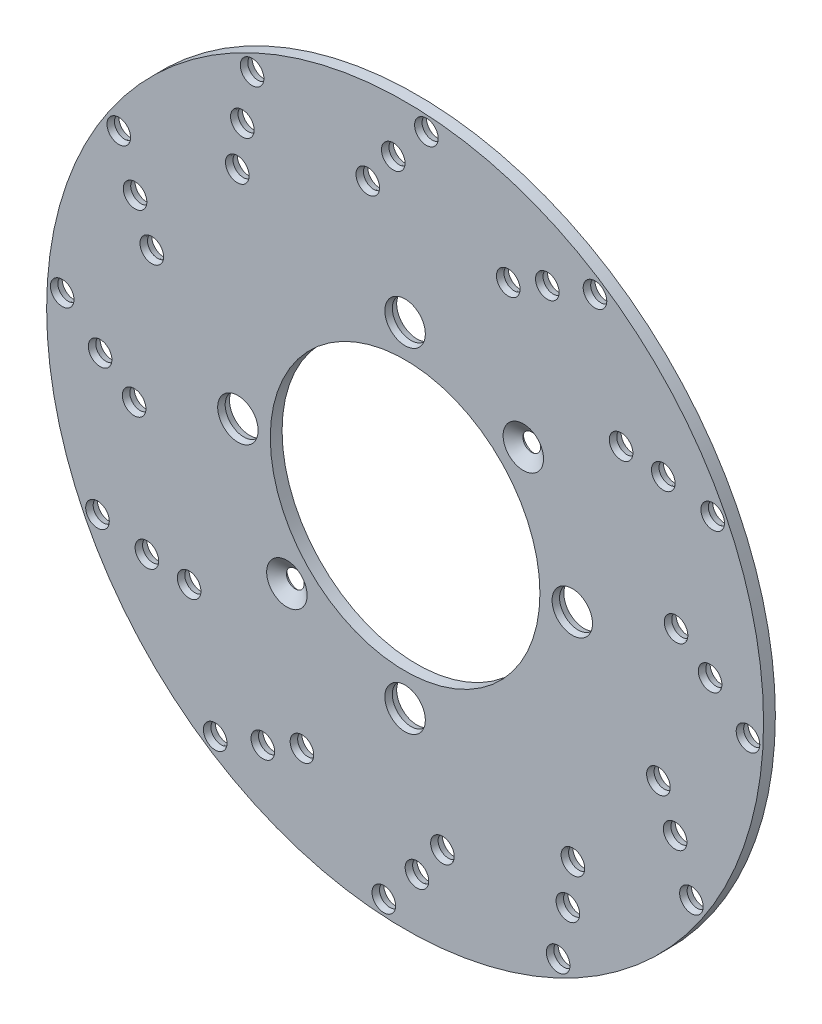
from build123d import *

# Parameters (mm, degrees)
SKETCH_1_R                    = 106.35
SKETCH_1_R_2                  = 40
EXTRUDE_1_DEPTH               = 3.5
SKETCH_2_R                    = 3.5
CUT_EXTRUDE_1_DEPTH           = 1.75
CUT_EXTRUDE_1_TAPER           = 15
CUT_EXTRUDE_START             = -3.5
SKETCH_2_6_R                  = 3.5
CUT_EXTRUDE_2_DEPTH           = 1.75
CUT_EXTRUDE_2_TAPER           = 15
SKETCH_2_7_R                  = 6
CUT_EXTRUDE_3_DEPTH           = 1.75
CUT_EXTRUDE_3_DRAFT           = -15
CUT_EXTRUDE_3_PROFILE_2_DEPTH = 1.75
CUT_EXTRUDE_3_PROFILE_2_DRAFT = -15
CUT_EXTRUDE_3_PROFILE_3_DEPTH = 1.75
CUT_EXTRUDE_3_PROFILE_3_DRAFT = -15
CUT_EXTRUDE_3_PROFILE_4_DEPTH = 1.75
CUT_EXTRUDE_3_PROFILE_4_DRAFT = -15
SKETCH_2_8_R                  = 6
CUT_EXTRUDE_4_DEPTH           = 1.75
CUT_EXTRUDE_4_DRAFT           = 15
CUT_EXTRUDE_4_PROFILE_2_DEPTH = 1.75
CUT_EXTRUDE_4_PROFILE_2_DRAFT = 15
CUT_EXTRUDE_4_PROFILE_3_DEPTH = 1.75
CUT_EXTRUDE_4_PROFILE_3_DRAFT = 15
CUT_EXTRUDE_4_PROFILE_4_DEPTH = 1.75
CUT_EXTRUDE_4_PROFILE_4_DRAFT = 15
SKETCH_6_R                    = 3.5
CUT_EXTRUDE_5_DEPTH           = 1
SKETCH_2_14_R                 = 6
CUT_EXTRUDE_7_DEPTH           = 2.5
CUT_EXTRUDE_7_DRAFT           = -53.5
SKETCH_2_16_R                 = 6
CUT_EXTRUDE_9_DEPTH           = 2.5
CUT_EXTRUDE_9_DRAFT           = -53.5


with BuildPart() as part:
    # 스케치1 → 보스-돌출1 (new body)
    with BuildSketch(Plane.XY):
        Circle(SKETCH_1_R)
        Circle(SKETCH_1_R_2, mode=Mode.SUBTRACT)
    extrude(amount=EXTRUDE_1_DEPTH)

    # 스케치2 → 컷-돌출1 (cut)
    with BuildSketch(Plane.XY.offset(3.5)):
        with Locations((56.332708309, 84.943277612)):
            Circle(SKETCH_2_R)
        with Locations((42.19916889, 80.122006401)):
            Circle(SKETCH_2_R)
        with Locations((30.601660309, 75.150814471)):
            Circle(SKETCH_2_R)
        with Locations((64.077222461, 49.781684292)):
            Circle(SKETCH_2_R)
        with Locations((91.257195266, 45.396682138)):
            Circle(SKETCH_2_R)
        with Locations((76.606555478, 48.2881085)):
            Circle(SKETCH_2_R)
        with Locations((80.383344601, 11.07359201)):
            Circle(SKETCH_2_R)
        with Locations((101.729390447, -6.313917654)):
            Circle(SKETCH_2_R)
        with Locations((90.487277391, 3.515450923)):
            Circle(SKETCH_2_R)
        with Locations((75.150814471, -30.601660309)):
            Circle(SKETCH_2_R)
        with Locations((84.943277612, -56.332708309)):
            Circle(SKETCH_2_R)
        with Locations((80.122006401, -42.19916889)):
            Circle(SKETCH_2_R)
        with Locations((49.781684292, -64.077222461)):
            Circle(SKETCH_2_R)
        with Locations((45.396682138, -91.257195266)):
            Circle(SKETCH_2_R)
        with Locations((48.2881085, -76.606555478)):
            Circle(SKETCH_2_R)
        with Locations((11.07359201, -80.383344601)):
            Circle(SKETCH_2_R)
        with Locations((-6.313917654, -101.729390447)):
            Circle(SKETCH_2_R)
        with Locations((3.515450923, -90.487277391)):
            Circle(SKETCH_2_R)
        with Locations((-30.601660309, -75.150814471)):
            Circle(SKETCH_2_R)
        with Locations((-56.332708309, -84.943277612)):
            Circle(SKETCH_2_R)
        with Locations((-42.19916889, -80.122006401)):
            Circle(SKETCH_2_R)
        with Locations((-64.077222461, -49.781684292)):
            Circle(SKETCH_2_R)
        with Locations((-91.257195266, -45.396682138)):
            Circle(SKETCH_2_R)
        with Locations((-76.606555478, -48.2881085)):
            Circle(SKETCH_2_R)
        with Locations((-80.383344601, -11.07359201)):
            Circle(SKETCH_2_R)
        with Locations((-101.729390447, 6.313917654)):
            Circle(SKETCH_2_R)
        with Locations((-90.487277391, -3.515450923)):
            Circle(SKETCH_2_R)
        with Locations((-75.150814471, 30.601660309)):
            Circle(SKETCH_2_R)
        with Locations((-84.943277612, 56.332708309)):
            Circle(SKETCH_2_R)
        with Locations((-80.122006401, 42.19916889)):
            Circle(SKETCH_2_R)
        with Locations((-49.781684292, 64.077222461)):
            Circle(SKETCH_2_R)
        with Locations((-45.396682138, 91.257195266)):
            Circle(SKETCH_2_R)
        with Locations((-48.2881085, 76.606555478)):
            Circle(SKETCH_2_R)
        with Locations((-11.07359201, 80.383344601)):
            Circle(SKETCH_2_R)
        with Locations((6.313917654, 101.729390447)):
            Circle(SKETCH_2_R)
        with Locations((-3.515450923, 90.487277391)):
            Circle(SKETCH_2_R)
    extrude(amount=-CUT_EXTRUDE_1_DEPTH, taper=CUT_EXTRUDE_1_TAPER, mode=Mode.SUBTRACT)

    # 스케치2<6> → 컷-돌출2 (cut)
    with BuildSketch(Plane.XY.offset(3.5).offset(CUT_EXTRUDE_START)):
        with Locations((56.332708309, 84.943277612)):
            Circle(SKETCH_2_6_R)
        with Locations((42.19916889, 80.122006401)):
            Circle(SKETCH_2_6_R)
        with Locations((30.601660309, 75.150814471)):
            Circle(SKETCH_2_6_R)
        with Locations((64.077222461, 49.781684292)):
            Circle(SKETCH_2_6_R)
        with Locations((91.257195266, 45.396682138)):
            Circle(SKETCH_2_6_R)
        with Locations((76.606555478, 48.2881085)):
            Circle(SKETCH_2_6_R)
        with Locations((80.383344601, 11.07359201)):
            Circle(SKETCH_2_6_R)
        with Locations((101.729390447, -6.313917654)):
            Circle(SKETCH_2_6_R)
        with Locations((90.487277391, 3.515450923)):
            Circle(SKETCH_2_6_R)
        with Locations((75.150814471, -30.601660309)):
            Circle(SKETCH_2_6_R)
        with Locations((84.943277612, -56.332708309)):
            Circle(SKETCH_2_6_R)
        with Locations((80.122006401, -42.19916889)):
            Circle(SKETCH_2_6_R)
        with Locations((49.781684292, -64.077222461)):
            Circle(SKETCH_2_6_R)
        with Locations((45.396682138, -91.257195266)):
            Circle(SKETCH_2_6_R)
        with Locations((48.2881085, -76.606555478)):
            Circle(SKETCH_2_6_R)
        with Locations((11.07359201, -80.383344601)):
            Circle(SKETCH_2_6_R)
        with Locations((-6.313917654, -101.729390447)):
            Circle(SKETCH_2_6_R)
        with Locations((3.515450923, -90.487277391)):
            Circle(SKETCH_2_6_R)
        with Locations((-30.601660309, -75.150814471)):
            Circle(SKETCH_2_6_R)
        with Locations((-56.332708309, -84.943277612)):
            Circle(SKETCH_2_6_R)
        with Locations((-42.19916889, -80.122006401)):
            Circle(SKETCH_2_6_R)
        with Locations((-64.077222461, -49.781684292)):
            Circle(SKETCH_2_6_R)
        with Locations((-91.257195266, -45.396682138)):
            Circle(SKETCH_2_6_R)
        with Locations((-76.606555478, -48.2881085)):
            Circle(SKETCH_2_6_R)
        with Locations((-80.383344601, -11.07359201)):
            Circle(SKETCH_2_6_R)
        with Locations((-101.729390447, 6.313917654)):
            Circle(SKETCH_2_6_R)
        with Locations((-90.487277391, -3.515450923)):
            Circle(SKETCH_2_6_R)
        with Locations((-75.150814471, 30.601660309)):
            Circle(SKETCH_2_6_R)
        with Locations((-84.943277612, 56.332708309)):
            Circle(SKETCH_2_6_R)
        with Locations((-80.122006401, 42.19916889)):
            Circle(SKETCH_2_6_R)
        with Locations((-49.781684292, 64.077222461)):
            Circle(SKETCH_2_6_R)
        with Locations((-45.396682138, 91.257195266)):
            Circle(SKETCH_2_6_R)
        with Locations((-48.2881085, 76.606555478)):
            Circle(SKETCH_2_6_R)
        with Locations((-11.07359201, 80.383344601)):
            Circle(SKETCH_2_6_R)
        with Locations((6.313917654, 101.729390447)):
            Circle(SKETCH_2_6_R)
        with Locations((-3.515450923, 90.487277391)):
            Circle(SKETCH_2_6_R)
    extrude(amount=CUT_EXTRUDE_2_DEPTH, taper=CUT_EXTRUDE_2_TAPER, mode=Mode.SUBTRACT)


with BuildPart() as cut_extrude_3_tool:
    # 스케치2<7> → 컷-돌출3 (with draft: the straight prism first)
    with BuildSketch(Plane.XY.offset(3.5)):
        with Locations((0, 49.6)):
            Circle(SKETCH_2_7_R)
    extrude(amount=-CUT_EXTRUDE_3_DEPTH)
    # 컷-돌출3: the draft: its side faces are tilted about the plane it starts from
    cut_extrude_3_sides = [cut_extrude_3_tool.faces().sort_by_distance(p)[0] for p in [
        (-6, 49.6, 2.625),
    ]]
    draft(cut_extrude_3_sides, Plane.XY.offset(3.5), CUT_EXTRUDE_3_DRAFT)


with BuildPart() as part_1:
    add(part.part)

    # 컷-돌출3: cut by cut_extrude_3_tool
    add(cut_extrude_3_tool.part, mode=Mode.SUBTRACT)


with BuildPart() as cut_extrude_3_profile_2_tool:
    # 스케치2<7> → 컷-돌출3 profile 2 (with draft: the straight prism first)
    with BuildSketch(Plane.XY.offset(3.5)):
        with Locations((49.6, 0)):
            Circle(SKETCH_2_7_R)
    extrude(amount=-CUT_EXTRUDE_3_PROFILE_2_DEPTH)
    # 컷-돌출3 profile 2: the draft: its side faces are tilted about the plane it starts from
    cut_extrude_3_profile_2_sides = [cut_extrude_3_profile_2_tool.faces().sort_by_distance(p)[0] for p in [
        (43.6, 0, 2.625),
    ]]
    draft(cut_extrude_3_profile_2_sides, Plane.XY.offset(3.5), CUT_EXTRUDE_3_PROFILE_2_DRAFT)


with BuildPart() as part_2:
    add(part_1.part)

    # 컷-돌출3 profile 2: cut by cut_extrude_3_profile_2_tool
    add(cut_extrude_3_profile_2_tool.part, mode=Mode.SUBTRACT)


with BuildPart() as cut_extrude_3_profile_3_tool:
    # 스케치2<7> → 컷-돌출3 profile 3 (with draft: the straight prism first)
    with BuildSketch(Plane.XY.offset(3.5)):
        with Locations((0, -49.6)):
            Circle(SKETCH_2_7_R)
    extrude(amount=-CUT_EXTRUDE_3_PROFILE_3_DEPTH)
    # 컷-돌출3 profile 3: the draft: its side faces are tilted about the plane it starts from
    cut_extrude_3_profile_3_sides = [cut_extrude_3_profile_3_tool.faces().sort_by_distance(p)[0] for p in [
        (-6, -49.6, 2.625),
    ]]
    draft(cut_extrude_3_profile_3_sides, Plane.XY.offset(3.5), CUT_EXTRUDE_3_PROFILE_3_DRAFT)


with BuildPart() as part_3:
    add(part_2.part)

    # 컷-돌출3 profile 3: cut by cut_extrude_3_profile_3_tool
    add(cut_extrude_3_profile_3_tool.part, mode=Mode.SUBTRACT)


with BuildPart() as cut_extrude_3_profile_4_tool:
    # 스케치2<7> → 컷-돌출3 profile 4 (with draft: the straight prism first)
    with BuildSketch(Plane.XY.offset(3.5)):
        with Locations((-49.6, 0)):
            Circle(SKETCH_2_7_R)
    extrude(amount=-CUT_EXTRUDE_3_PROFILE_4_DEPTH)
    # 컷-돌출3 profile 4: the draft: its side faces are tilted about the plane it starts from
    cut_extrude_3_profile_4_sides = [cut_extrude_3_profile_4_tool.faces().sort_by_distance(p)[0] for p in [
        (-55.6, 0, 2.625),
    ]]
    draft(cut_extrude_3_profile_4_sides, Plane.XY.offset(3.5), CUT_EXTRUDE_3_PROFILE_4_DRAFT)


with BuildPart() as part_4:
    add(part_3.part)

    # 컷-돌출3 profile 4: cut by cut_extrude_3_profile_4_tool
    add(cut_extrude_3_profile_4_tool.part, mode=Mode.SUBTRACT)


with BuildPart() as cut_extrude_4_tool:
    # 스케치2<8> → 컷-돌출4 (with draft: the straight prism first)
    with BuildSketch(Plane.XY.offset(3.5).offset(CUT_EXTRUDE_START)):
        with Locations((0, 49.6)):
            Circle(SKETCH_2_8_R)
    extrude(amount=CUT_EXTRUDE_4_DEPTH)
    # 컷-돌출4: the draft: its side faces are tilted about the plane it starts from
    cut_extrude_4_sides = [cut_extrude_4_tool.faces().sort_by_distance(p)[0] for p in [
        (-6, 49.6, 0.875),
    ]]
    draft(cut_extrude_4_sides, Plane.XY.offset(3.5).offset(CUT_EXTRUDE_START), CUT_EXTRUDE_4_DRAFT)


with BuildPart() as part_5:
    add(part_4.part)

    # 컷-돌출4: cut by cut_extrude_4_tool
    add(cut_extrude_4_tool.part, mode=Mode.SUBTRACT)


with BuildPart() as cut_extrude_4_profile_2_tool:
    # 스케치2<8> → 컷-돌출4 profile 2 (with draft: the straight prism first)
    with BuildSketch(Plane.XY.offset(3.5).offset(CUT_EXTRUDE_START)):
        with Locations((49.6, 0)):
            Circle(SKETCH_2_8_R)
    extrude(amount=CUT_EXTRUDE_4_PROFILE_2_DEPTH)
    # 컷-돌출4 profile 2: the draft: its side faces are tilted about the plane it starts from
    cut_extrude_4_profile_2_sides = [cut_extrude_4_profile_2_tool.faces().sort_by_distance(p)[0] for p in [
        (43.6, 0, 0.875),
    ]]
    draft(cut_extrude_4_profile_2_sides, Plane.XY.offset(3.5).offset(CUT_EXTRUDE_START), CUT_EXTRUDE_4_PROFILE_2_DRAFT)


with BuildPart() as part_6:
    add(part_5.part)

    # 컷-돌출4 profile 2: cut by cut_extrude_4_profile_2_tool
    add(cut_extrude_4_profile_2_tool.part, mode=Mode.SUBTRACT)


with BuildPart() as cut_extrude_4_profile_3_tool:
    # 스케치2<8> → 컷-돌출4 profile 3 (with draft: the straight prism first)
    with BuildSketch(Plane.XY.offset(3.5).offset(CUT_EXTRUDE_START)):
        with Locations((0, -49.6)):
            Circle(SKETCH_2_8_R)
    extrude(amount=CUT_EXTRUDE_4_PROFILE_3_DEPTH)
    # 컷-돌출4 profile 3: the draft: its side faces are tilted about the plane it starts from
    cut_extrude_4_profile_3_sides = [cut_extrude_4_profile_3_tool.faces().sort_by_distance(p)[0] for p in [
        (-6, -49.6, 0.875),
    ]]
    draft(cut_extrude_4_profile_3_sides, Plane.XY.offset(3.5).offset(CUT_EXTRUDE_START), CUT_EXTRUDE_4_PROFILE_3_DRAFT)


with BuildPart() as part_7:
    add(part_6.part)

    # 컷-돌출4 profile 3: cut by cut_extrude_4_profile_3_tool
    add(cut_extrude_4_profile_3_tool.part, mode=Mode.SUBTRACT)


with BuildPart() as cut_extrude_4_profile_4_tool:
    # 스케치2<8> → 컷-돌출4 profile 4 (with draft: the straight prism first)
    with BuildSketch(Plane.XY.offset(3.5).offset(CUT_EXTRUDE_START)):
        with Locations((-49.6, 0)):
            Circle(SKETCH_2_8_R)
    extrude(amount=CUT_EXTRUDE_4_PROFILE_4_DEPTH)
    # 컷-돌출4 profile 4: the draft: its side faces are tilted about the plane it starts from
    cut_extrude_4_profile_4_sides = [cut_extrude_4_profile_4_tool.faces().sort_by_distance(p)[0] for p in [
        (-55.6, 0, 0.875),
    ]]
    draft(cut_extrude_4_profile_4_sides, Plane.XY.offset(3.5).offset(CUT_EXTRUDE_START), CUT_EXTRUDE_4_PROFILE_4_DRAFT)


with BuildPart() as part_8:
    add(part_7.part)

    # 컷-돌출4 profile 4: cut by cut_extrude_4_profile_4_tool
    add(cut_extrude_4_profile_4_tool.part, mode=Mode.SUBTRACT)

    # 스케치6 → 컷-돌출5 (cut)
    with BuildSketch(Plane(origin=(0, 0, 0), x_dir=(-1, 0, 0), z_dir=(0, 0, -1))):
        with Locations((-35.072496347, 35.072496347)):
            Circle(SKETCH_6_R)
        with Locations((35.072496347, -35.072496347)):
            Circle(SKETCH_6_R)
    extrude(amount=-CUT_EXTRUDE_5_DEPTH, mode=Mode.SUBTRACT)


with BuildPart() as cut_extrude_7_tool:
    # 스케치2<14> → 컷-돌출7 (with draft: the straight prism first)
    with BuildSketch(Plane.XY.offset(3.5)):
        with Locations((-35.072496347, -35.072496347)):
            Circle(SKETCH_2_14_R)
    extrude(amount=-CUT_EXTRUDE_7_DEPTH)
    # 컷-돌출7: the draft: its side faces are tilted about the plane it starts from
    cut_extrude_7_sides = [cut_extrude_7_tool.faces().sort_by_distance(p)[0] for p in [
        (-41.072496347, -35.072496347, 2.25),
    ]]
    draft(cut_extrude_7_sides, Plane.XY.offset(3.5), CUT_EXTRUDE_7_DRAFT)


with BuildPart() as part_9:
    add(part_8.part)

    # 컷-돌출7: cut by cut_extrude_7_tool
    add(cut_extrude_7_tool.part, mode=Mode.SUBTRACT)


with BuildPart() as cut_extrude_9_tool:
    # 스케치2<16> → 컷-돌출9 (with draft: the straight prism first)
    with BuildSketch(Plane.XY.offset(3.5)):
        with Locations((35.072496347, 35.072496347)):
            Circle(SKETCH_2_16_R)
    extrude(amount=-CUT_EXTRUDE_9_DEPTH)
    # 컷-돌출9: the draft: its side faces are tilted about the plane it starts from
    cut_extrude_9_sides = [cut_extrude_9_tool.faces().sort_by_distance(p)[0] for p in [
        (29.072496347, 35.072496347, 2.25),
    ]]
    draft(cut_extrude_9_sides, Plane.XY.offset(3.5), CUT_EXTRUDE_9_DRAFT)


with BuildPart() as part_10:
    add(part_9.part)

    # 컷-돌출9: cut by cut_extrude_9_tool
    add(cut_extrude_9_tool.part, mode=Mode.SUBTRACT)


solid = part_10.part
